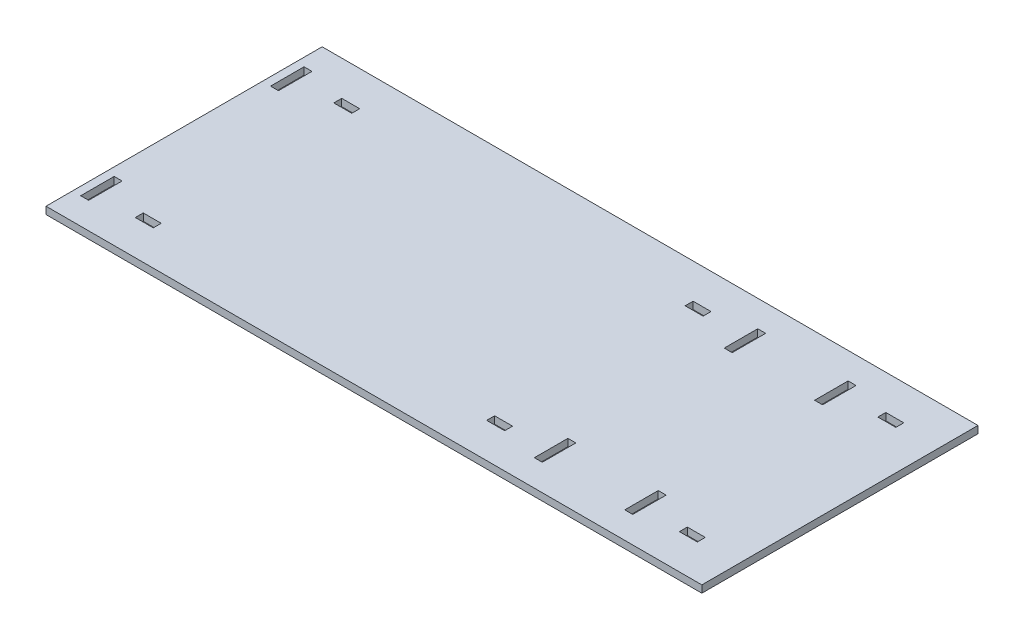
from build123d import *

# Parameters (mm, degrees)
SKETCH1_W           = 482.6
SKETCH1_H           = 203.2
BOSS_EXTRUDE1_DEPTH = 5.334
SKETCH5_W           = 5.842
SKETCH5_H           = 24.638
SKETCH5_W_2         = 13.208
SKETCH5_H_2         = 5.842
CUT_EXTRUDE3_DEPTH  = 262.871536361


with BuildPart() as part:
    # Sketch1 → Boss-Extrude1 (new body)
    with BuildSketch(Plane(origin=(0, 0, 0), x_dir=(1, 0, 0), z_dir=(0, 1, 0))):
        Rectangle(SKETCH1_W, SKETCH1_H)
    extrude(amount=BOSS_EXTRUDE1_DEPTH)

    # Sketch5 → Cut-Extrude3 (cut, through all)
    with BuildSketch(Plane.XZ):
        with Locations((-232.283, 69.85)):
            Rectangle(SKETCH5_W, SKETCH5_H)
        with Locations((101.567, 69.85)):
            Rectangle(SKETCH5_W, SKETCH5_H)
        with Locations((168.06, 69.85)):
            Rectangle(SKETCH5_W, SKETCH5_H)
        with Locations((168.06, -69.85)):
            Rectangle(SKETCH5_W, SKETCH5_H)
        with Locations((101.567, -69.85)):
            Rectangle(SKETCH5_W, SKETCH5_H)
        with Locations((-232.283, -69.85)):
            Rectangle(SKETCH5_W, SKETCH5_H)
        with Locations((63.9115, -73.025)):
            Rectangle(SKETCH5_W_2, SKETCH5_H_2)
        with Locations((-194.6275, -73.025)):
            Rectangle(SKETCH5_W_2, SKETCH5_H_2)
        with Locations((63.9115, 73.025)):
            Rectangle(SKETCH5_W_2, SKETCH5_H_2)
        with Locations((205.7155, -73.025)):
            Rectangle(SKETCH5_W_2, SKETCH5_H_2)
        with Locations((205.7155, 73.025)):
            Rectangle(SKETCH5_W_2, SKETCH5_H_2)
        with Locations((-194.6275, 73.025)):
            Rectangle(SKETCH5_W_2, SKETCH5_H_2)
    extrude(amount=-CUT_EXTRUDE3_DEPTH, mode=Mode.SUBTRACT)


solid = part.part
